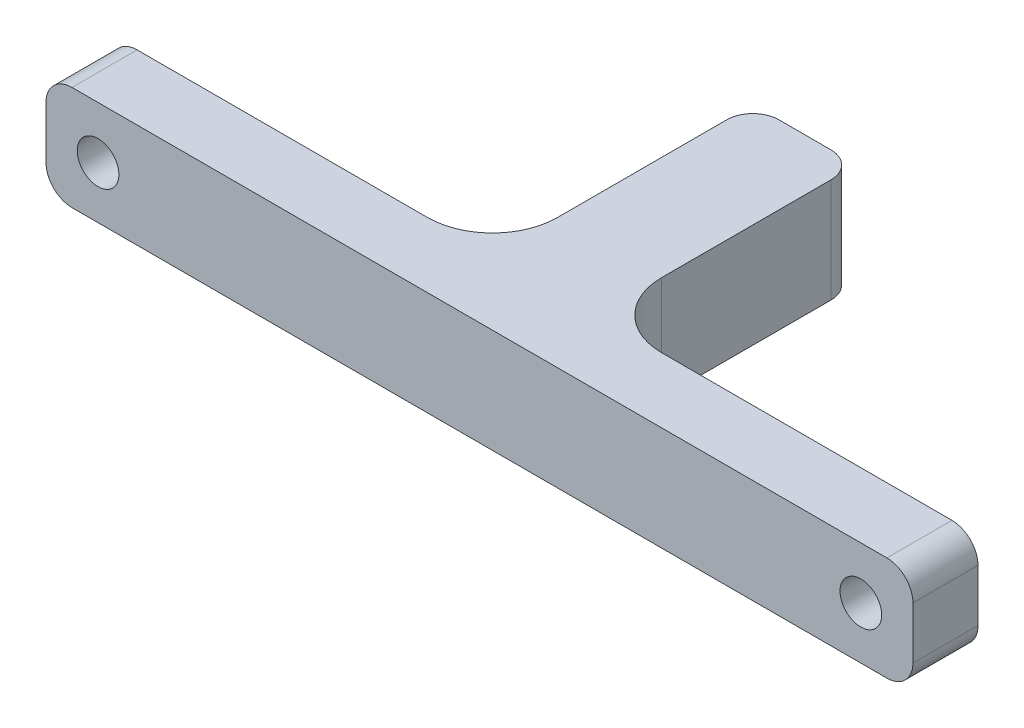
from build123d import *

# Parameters (mm, degrees)
SKETCH_1_W      = 66.6
SKETCH_1_H      = 8
SKETCH_1_R      = 1.6
EXTRUDE_1_DEPTH = 5
SKETCH_2_W      = 8
SKETCH_2_H      = 20
EXTRUDE_2_DEPTH = 8
FILLET_1_R      = 2
FILLET_2_R      = 5
FILLET_3_R      = 2


with BuildPart() as part:
    # 草图1 → 凸台-拉伸1 (new body)
    with BuildSketch(Plane.XY):
        Rectangle(SKETCH_1_W, SKETCH_1_H)
        with Locations((-29.3, 0)):
            Circle(SKETCH_1_R, mode=Mode.SUBTRACT)
        with Locations(Location((29.3, 0, 0), (0, 0, 180))):
            Circle(SKETCH_1_R, mode=Mode.SUBTRACT)
    extrude(amount=EXTRUDE_1_DEPTH)

    # 草图2 → 凸台-拉伸2 (add)
    with BuildSketch(Plane(origin=(0, 4, 0), x_dir=(1, 0, 0), z_dir=(0, 1, 0))):
        with Locations((0, 10)):
            Rectangle(SKETCH_2_W, SKETCH_2_H)
    extrude(amount=-EXTRUDE_2_DEPTH)

    # 圆角1
    fillet_1_edges = [part.edges().sort_by_distance(p)[0] for p in [
        (-33.3, 4, 2.5),
        (33.3, 4, 2.5),
        (33.3, -4, 2.5),
        (-33.3, -4, 2.5),
    ]]
    fillet(fillet_1_edges, radius=FILLET_1_R)

    # 圆角2
    fillet_2_edges = [part.edges().sort_by_distance(p)[0] for p in [
        (4, 0, 0),
        (-4, 0, 0),
    ]]
    fillet(fillet_2_edges, radius=FILLET_2_R)

    # 圆角3
    fillet_3_edges = [part.edges().sort_by_distance(p)[0] for p in [
        (-4, 0, -20),
        (4, 0, -20),
    ]]
    fillet(fillet_3_edges, radius=FILLET_3_R)


solid = part.part
